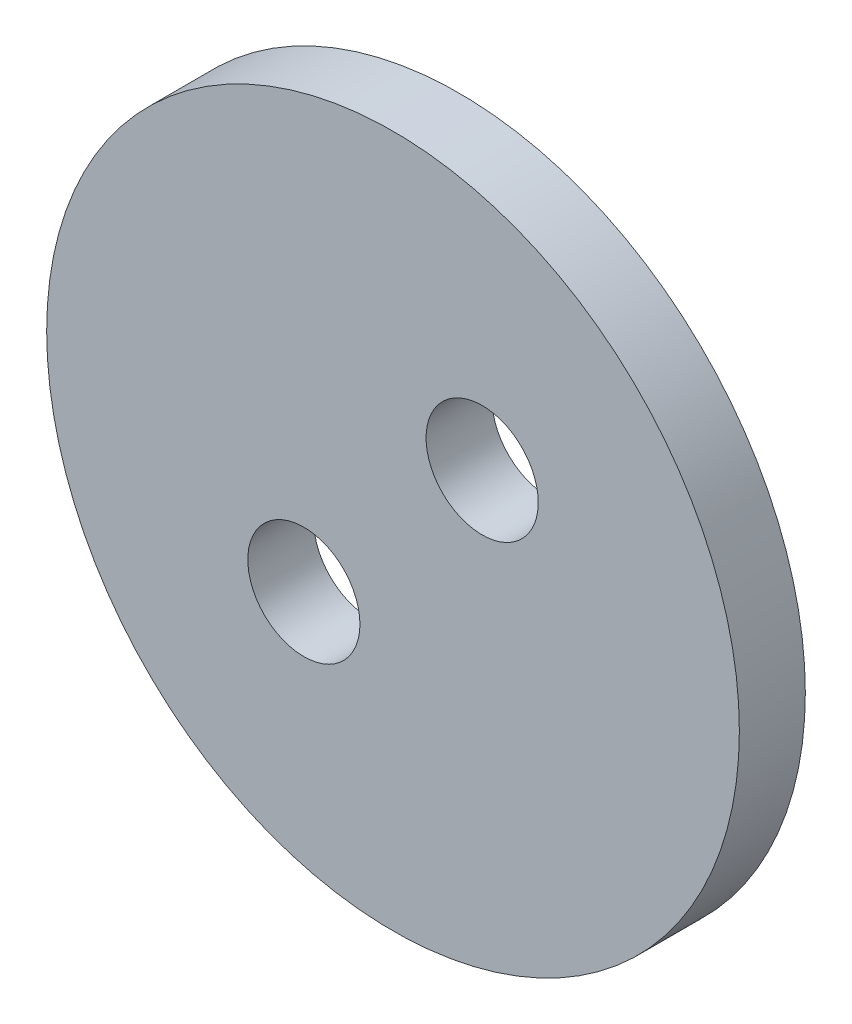
from build123d import *

# Parameters (mm, degrees)
SKETCH_1_R        = 10.5
EXTRUDE_1_DEPTH   = 2
HOLE_WIZARD_M31_D = 3.4


with BuildPart() as part:
    # Эскиз1 → Бобышка-Вытянуть1 (new body)
    with BuildSketch(Plane.XY):
        Circle(SKETCH_1_R)
    extrude(amount=EXTRUDE_1_DEPTH)

    # Отверстие с зазором M31 (through all)
    with Locations(Plane.XY.offset(2)):
        with Locations((2.702365719, 2.949104868), (-2.702365719, -2.949104868)):
            Hole(HOLE_WIZARD_M31_D / 2)


solid = part.part
